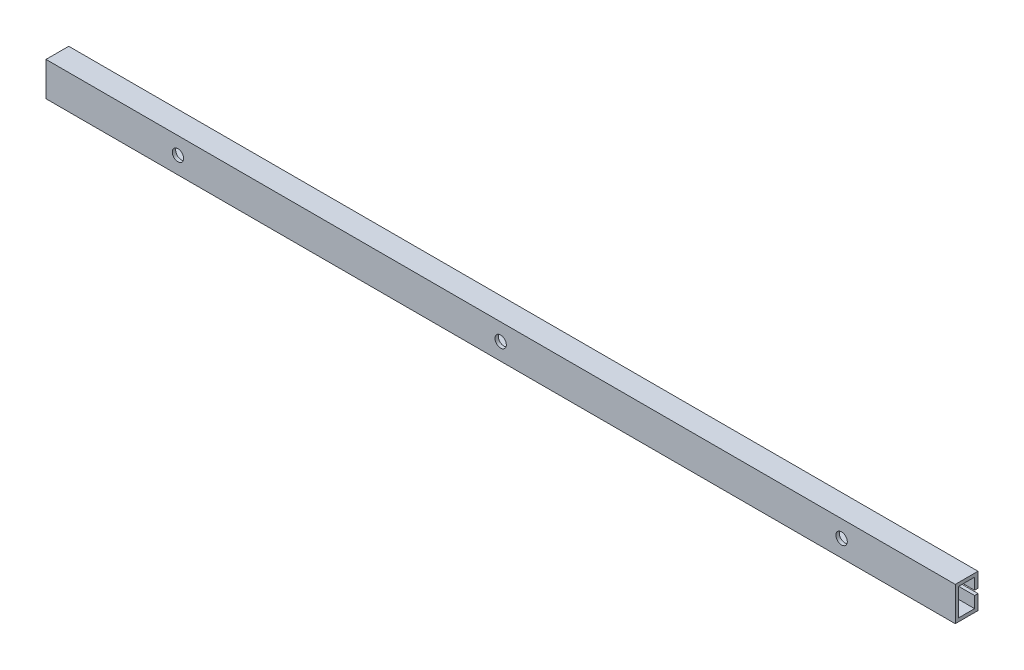
from build123d import *

# Parameters (mm, degrees)
CROQUIS1_W              = 1000
CROQUIS1_H              = 30
SALIENTE_EXTRUIR1_DEPTH = 20
CORTAR_EXTRUIR1_DEPTH   = 1001.649788887
CROQUIS3_W              = 100
CROQUIS3_H              = 30
CORTAR_EXTRUIR2_DEPTH   = 502.29831438
CROQUIS4_R              = 5
CORTAR_EXTRUIR3_DEPTH   = 10


with BuildPart() as part:
    # Croquis1 → Saliente-Extruir1 (new body)
    with BuildSketch(Plane.XY):
        with Locations((0, 15)):
            Rectangle(CROQUIS1_W, CROQUIS1_H)
    extrude(amount=SALIENTE_EXTRUIR1_DEPTH)

    # Croquis2 → Cortar-Extruir1 (cut, through all)
    with BuildSketch(Plane(origin=(500, 0, 0), x_dir=(0, 0, -1), z_dir=(1, 0, 0))):
        Polygon((-17, 27), (-17, 3), (-3, 3), (-3, 12.998729457), (0, 12.998729457), (0, 17), (-3, 17), (-3, 27), align=None)
    extrude(amount=-CORTAR_EXTRUIR1_DEPTH, mode=Mode.SUBTRACT)

    # Croquis3 → Cortar-Extruir2 (cut, through all)
    with BuildSketch(Plane.XY.offset(20)):
        with Locations((-450, 15)):
            Rectangle(CROQUIS3_W, CROQUIS3_H)
        with Locations((450, 15)):
            Rectangle(CROQUIS3_W, CROQUIS3_H)
    extrude(amount=-CORTAR_EXTRUIR2_DEPTH, mode=Mode.SUBTRACT)

    # Croquis4 → Cortar-Extruir3 (cut)
    with BuildSketch(Plane.XY.offset(20)):
        with Locations((300, 15)):
            Circle(CROQUIS4_R)
        with Locations((0, 15)):
            Circle(CROQUIS4_R)
        with Locations((-283.92, 15)):
            Circle(CROQUIS4_R)
    extrude(amount=-CORTAR_EXTRUIR3_DEPTH, mode=Mode.SUBTRACT)


solid = part.part
